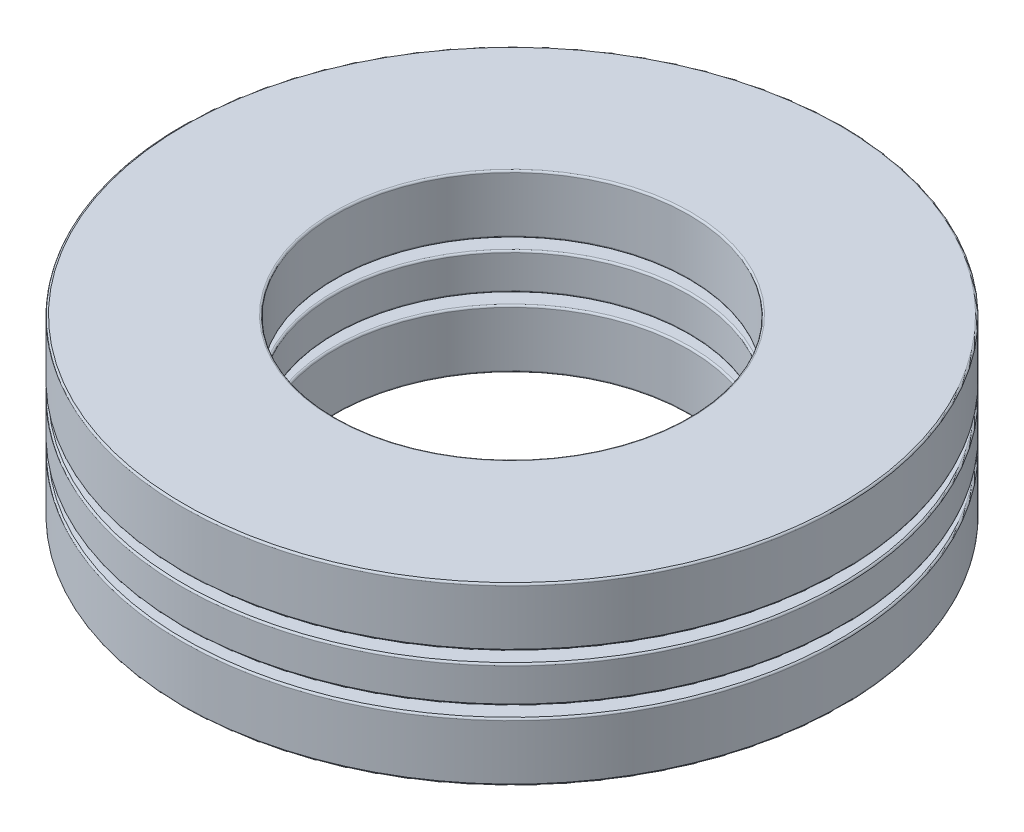
from build123d import *

# Parameters (mm, degrees)
SKETCH1_W         = 5.51815
SKETCH1_H         = 1.317625
CIRPATTERN1_COUNT = 5
CIRPATTERN1_ANGLE = 288
CIRPATTERN2_COUNT = 5
SKETCH4_W         = 5.51815
SKETCH4_H         = 2.1082
FILLET1_R         = 0.063246
FILLET2_R         = 0.063246
FILLET3_R         = 0.063246


with BuildPart() as part:
    # Sketch1 → Revolve1 (revolve)
    with BuildSketch(Plane(origin=(0, 0, 0), x_dir=(0, 0, -1), z_dir=(1, 0, 0)), mode=Mode.PRIVATE) as revolve1_sk:
        with Locations((-9.147175, 0)):
            Rectangle(SKETCH1_W, SKETCH1_H)
    revolve(revolve1_sk.sketch.rotate(Axis((0, -3.1623, 0), (0, 1, 0)), 180), axis=Axis((0, -3.1623, 0), (0, 1, 0)))

    # Sketch3 → Cut-Revolve1 (revolve, cut)
    with BuildSketch(Plane(origin=(0, 0, 0), x_dir=(0, 0, -1), z_dir=(1, 0, 0))):
        with BuildLine():
            Line((-9.147175, 1.0541), (-9.147175, -1.0541))
            ThreePointArc((-9.147175, -1.0541), (-10.201275, 0), (-9.147175, 1.0541))
        make_face()
    cut_revolve1 = revolve(axis=Axis((0, 1.0541, 9.147175), (0, -1, 0)), mode=Mode.SUBTRACT)

    # CirPattern2: Cut-Revolve1 ×5 about axis
    cirpattern2_axis = Axis((0, 0, 0), (0, 1, 0))
    for i in range(1, CIRPATTERN2_COUNT):
        add(cut_revolve1.rotate(cirpattern2_axis, i * 360 / CIRPATTERN2_COUNT), mode=Mode.SUBTRACT)

    # Fillet2
    fillet2_edges = [part.edges().sort_by_distance(p)[0] for p in [
        (0, 0.6588125, 11.90625),
        (0, 0.6588125, 6.3881),
        (0, -0.6588125, 6.3881),
        (0, -0.6588125, 11.90625),
    ]]
    fillet(fillet2_edges, radius=FILLET2_R)


with BuildPart() as body_2:
    # Sketch2 → Revolve2 (revolve)
    with BuildSketch(Plane(origin=(0, 0, 0), x_dir=(0, 0, -1), z_dir=(1, 0, 0))):
        with BuildLine():
            Line((-9.147175, 1.0541), (-9.147175, -1.0541))
            ThreePointArc((-9.147175, -1.0541), (-10.201275, 0), (-9.147175, 1.0541))
        make_face()
    revolve(axis=Axis((0, 1.0541, 9.147175), (0, -1, 0)))


with BuildPart() as cirpattern1_1:
    # CirPattern1: pattern copy
    add(body_2.part.rotate(Axis((0, 3.1623, 0), (0, -1, 0)), 1 * CIRPATTERN1_ANGLE / (CIRPATTERN1_COUNT - 1)))


with BuildPart() as cirpattern1_2:
    # CirPattern1: pattern copy
    add(body_2.part.rotate(Axis((0, 3.1623, 0), (0, -1, 0)), 2 * CIRPATTERN1_ANGLE / (CIRPATTERN1_COUNT - 1)))


with BuildPart() as cirpattern1_3:
    # CirPattern1: pattern copy
    add(body_2.part.rotate(Axis((0, 3.1623, 0), (0, -1, 0)), 3 * CIRPATTERN1_ANGLE / (CIRPATTERN1_COUNT - 1)))


with BuildPart() as cirpattern1_4:
    # CirPattern1: pattern copy
    add(body_2.part.rotate(Axis((0, 3.1623, 0), (0, -1, 0)), 4 * CIRPATTERN1_ANGLE / (CIRPATTERN1_COUNT - 1)))


with BuildPart() as body_7:
    # Sketch4 → Revolve3 (revolve)
    with BuildSketch(Plane(origin=(0, 0, 0), x_dir=(0, 0, -1), z_dir=(1, 0, 0)), mode=Mode.PRIVATE) as revolve3_sk:
        with Locations((-9.147175, 2.1082)):
            Rectangle(SKETCH4_W, SKETCH4_H)
        with Locations((-9.147175, -2.1082)):
            Rectangle(SKETCH4_W, SKETCH4_H)
    revolve(revolve3_sk.sketch.rotate(Axis((0, -3.1623, 0), (0, 1, 0)), 180), axis=Axis((0, -3.1623, 0), (0, 1, 0)))

    # Fillet1
    fillet1_edges = [body_7.edges().sort_by_distance(p)[0] for p in [
        (0, 1.0541, 11.90625),
        (0, 1.0541, 6.3881),
        (0, 3.1623, 6.3881),
        (0, 3.1623, 11.90625),
    ]]
    fillet(fillet1_edges, radius=FILLET1_R)

    # Fillet3
    fillet3_edges = [body_7.edges().sort_by_distance(p)[0] for p in [
        (0, -3.1623, 11.90625),
        (0, -3.1623, 6.3881),
        (0, -1.0541, 6.3881),
        (0, -1.0541, 11.90625),
    ]]
    fillet(fillet3_edges, radius=FILLET3_R)


solid = Compound([part.part, body_2.part, cirpattern1_1.part, cirpattern1_2.part, cirpattern1_3.part, cirpattern1_4.part, body_7.part])
